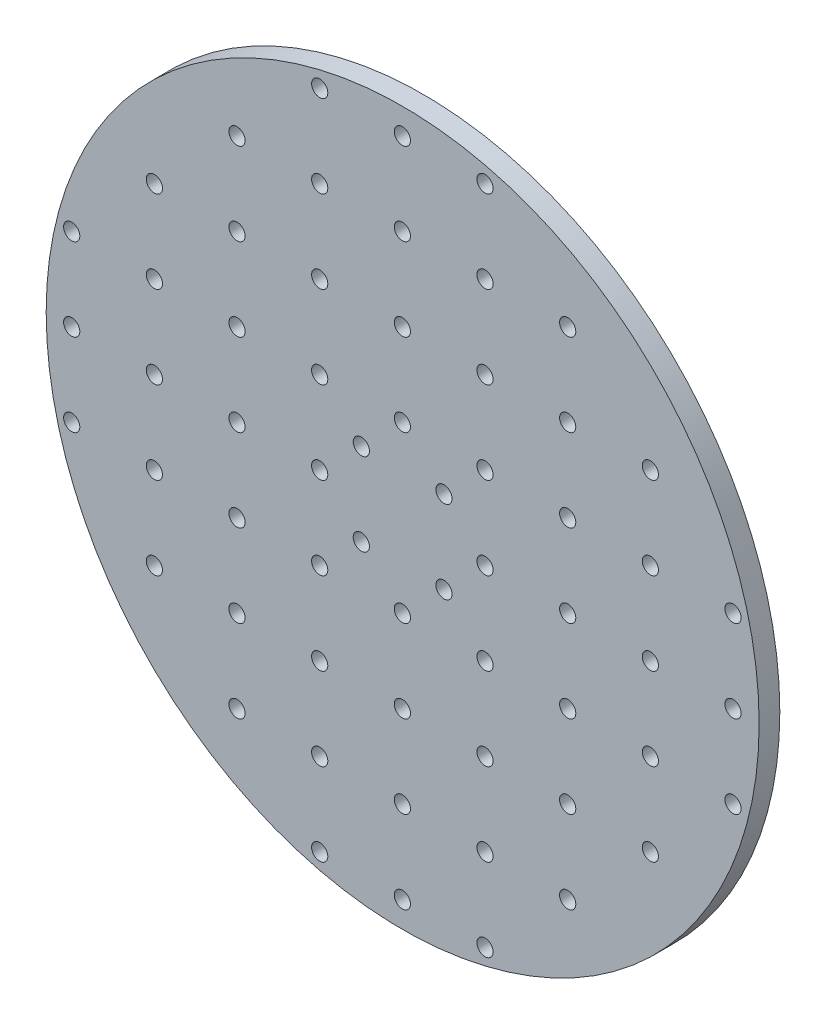
from build123d import *

# Parameters (mm, degrees)
SKETCH1_R           = 109.5375
SKETCH1_R_2         = 2.4892
BOSS_EXTRUDE1_DEPTH = 6.35
SKETCH2_R           = 2.4892
CUT_EXTRUDE1_DEPTH  = 6.35


with BuildPart() as part:
    # Sketch1 → Boss-Extrude1 (new body)
    with BuildSketch(Plane.XY):
        Circle(SKETCH1_R)
        with Locations((-12.7, 12.7)):
            Circle(SKETCH1_R_2, mode=Mode.SUBTRACT)
        with Locations((12.7, 12.7)):
            Circle(SKETCH1_R_2, mode=Mode.SUBTRACT)
        with Locations((12.7, -12.7)):
            Circle(SKETCH1_R_2, mode=Mode.SUBTRACT)
        with Locations((-12.7, -12.7)):
            Circle(SKETCH1_R_2, mode=Mode.SUBTRACT)
    extrude(amount=BOSS_EXTRUDE1_DEPTH)

    # Sketch2 → Cut-Extrude1 (cut)
    with BuildSketch(Plane.XY.offset(6.35)):
        with Locations((25.305046536, -101.6)):
            Circle(SKETCH2_R)
        with Locations((25.305046536, -76.2)):
            Circle(SKETCH2_R)
        with Locations((-76.294953464, 0)):
            Circle(SKETCH2_R)
        with Locations((-76.294953464, 25.4)):
            Circle(SKETCH2_R)
        with Locations((-76.294953464, 50.8)):
            Circle(SKETCH2_R)
        with Locations((-0.094953464, -76.2)):
            Circle(SKETCH2_R)
        with Locations((50.705046536, -76.2)):
            Circle(SKETCH2_R)
        with Locations((-25.494953464, -50.8)):
            Circle(SKETCH2_R)
        with Locations((-0.094953464, -50.8)):
            Circle(SKETCH2_R)
        with Locations((25.305046536, -50.8)):
            Circle(SKETCH2_R)
        with Locations((50.705046536, -50.8)):
            Circle(SKETCH2_R)
        with Locations((76.105046536, -50.8)):
            Circle(SKETCH2_R)
        with Locations((-50.894953464, -25.4)):
            Circle(SKETCH2_R)
        with Locations((-25.494953464, -25.4)):
            Circle(SKETCH2_R)
        with Locations((-0.094953464, -25.4)):
            Circle(SKETCH2_R)
        with Locations((25.305046536, -25.4)):
            Circle(SKETCH2_R)
        with Locations((50.705046536, -25.4)):
            Circle(SKETCH2_R)
        with Locations((76.105046536, -25.4)):
            Circle(SKETCH2_R)
        with Locations((101.505046536, -25.4)):
            Circle(SKETCH2_R)
        with Locations((-50.894953464, 0)):
            Circle(SKETCH2_R)
        with Locations((-25.494953464, 0)):
            Circle(SKETCH2_R)
        with Locations((25.305046536, 0)):
            Circle(SKETCH2_R)
        with Locations((50.705046536, 0)):
            Circle(SKETCH2_R)
        with Locations((76.105046536, 0)):
            Circle(SKETCH2_R)
        with Locations((101.505046536, 0)):
            Circle(SKETCH2_R)
        with Locations((-50.894953464, 25.4)):
            Circle(SKETCH2_R)
        with Locations((-25.494953464, 25.4)):
            Circle(SKETCH2_R)
        with Locations((-0.094953464, 25.4)):
            Circle(SKETCH2_R)
        with Locations((25.305046536, 25.4)):
            Circle(SKETCH2_R)
        with Locations((50.705046536, 25.4)):
            Circle(SKETCH2_R)
        with Locations((76.105046536, 25.4)):
            Circle(SKETCH2_R)
        with Locations((101.505046536, 25.4)):
            Circle(SKETCH2_R)
        with Locations((-50.894953464, 50.8)):
            Circle(SKETCH2_R)
        with Locations((-25.494953464, 50.8)):
            Circle(SKETCH2_R)
        with Locations((-0.094953464, 50.8)):
            Circle(SKETCH2_R)
        with Locations((25.305046536, 50.8)):
            Circle(SKETCH2_R)
        with Locations((50.705046536, 50.8)):
            Circle(SKETCH2_R)
        with Locations((76.105046536, 50.8)):
            Circle(SKETCH2_R)
        with Locations((-50.894953464, 76.2)):
            Circle(SKETCH2_R)
        with Locations((-25.494953464, 76.2)):
            Circle(SKETCH2_R)
        with Locations((-0.094953464, 76.2)):
            Circle(SKETCH2_R)
        with Locations((25.305046536, 76.2)):
            Circle(SKETCH2_R)
        with Locations((50.705046536, 76.2)):
            Circle(SKETCH2_R)
        with Locations((-25.494953464, 101.6)):
            Circle(SKETCH2_R)
        with Locations((-0.094953464, 101.6)):
            Circle(SKETCH2_R)
        with Locations((25.305046536, 101.6)):
            Circle(SKETCH2_R)
        with Locations((-25.494953464, -101.6)):
            Circle(SKETCH2_R)
        with Locations((-0.094953464, -101.6)):
            Circle(SKETCH2_R)
        with Locations((-50.894953464, -76.2)):
            Circle(SKETCH2_R)
        with Locations((-25.494953464, -76.2)):
            Circle(SKETCH2_R)
        with Locations((-76.294953464, -50.8)):
            Circle(SKETCH2_R)
        with Locations((-50.894953464, -50.8)):
            Circle(SKETCH2_R)
        with Locations((-76.294953464, -25.4)):
            Circle(SKETCH2_R)
        with Locations((-101.694953464, -25.4)):
            Circle(SKETCH2_R)
        with Locations((-101.694953464, 0)):
            Circle(SKETCH2_R)
        with Locations((-101.694953464, 25.4)):
            Circle(SKETCH2_R)
    extrude(amount=-CUT_EXTRUDE1_DEPTH, mode=Mode.SUBTRACT)


solid = part.part
